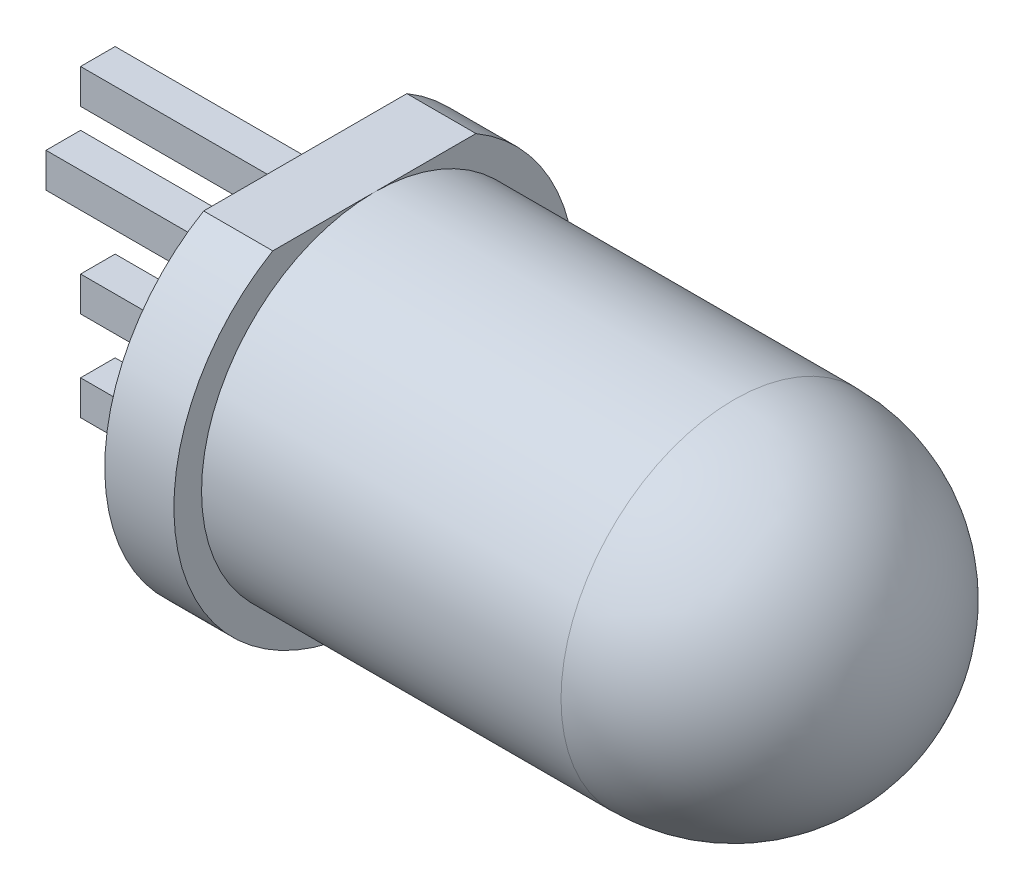
from build123d import *

# Parameters (mm, degrees)
SKETCH_3_W               = 1
SKETCH_3_H               = 2.9
CUT_EXTRUDE_1_DEPTH      = 10
SKETCH_5_W               = 0.5
SKETCH_5_H               = 0.5
EXTRUDE_1_DEPTH          = 3
SKETCH_5_3_W             = 0.5
SKETCH_5_3_H             = 0.5
EXTRUDE_2_DEPTH          = 3.5
CUT_EXTRUDE_2_DEPTH      = 5
CUT_EXTRUDE_2_DEPTH_BACK = 1
SKETCH_7_R               = 2
EXTRUDE_3_DEPTH          = 0.25
EXTRUDE_3_DEPTH_BACK     = 0.25


with BuildPart() as part:
    # 草图1 → 旋转1 (revolve)
    with BuildSketch(Plane.XY):
        with BuildLine():
            Line((0, 0), (8.7, 0))
            ThreePointArc((8.7, 0), (7.967766953, 1.767766953), (6.2, 2.5))
            Line((6.2, 2.5), (0, 2.5))
            Line((0, 2.5), (0, 0))
        make_face()
    revolve(axis=Axis((0, 0, 0), (1, 0, 0)))

    # 草图3 → 旋转2 (revolve)
    with BuildSketch(Plane.XY, mode=Mode.PRIVATE) as revolve_2_sk:
        with Locations((0.5, 1.45)):
            Rectangle(SKETCH_3_W, SKETCH_3_H)
    revolve(revolve_2_sk.sketch.rotate(Axis((0, 0, 0), (1, 0, 0)), 90), axis=Axis((0, 0, 0), (1, 0, 0)))

    # 草图4 → 切除-拉伸1 (cut)
    with BuildSketch(Plane.ZY):
        with BuildLine():
            Line((-1.469693846, 2.5), (1.469693846, 2.5))
            ThreePointArc((1.469693846, 2.5), (0, 2.9), (-1.469693846, 2.5))
        make_face()
    extrude(amount=-CUT_EXTRUDE_1_DEPTH, mode=Mode.SUBTRACT)

    # 草图5 → 凸台-拉伸1 (add)
    with BuildSketch(Plane.ZY):
        with Locations((0, 1.95)):
            Rectangle(SKETCH_5_W, SKETCH_5_H)
        with Locations((0, -0.65)):
            Rectangle(SKETCH_5_W, SKETCH_5_H)
        with Locations((0, -1.95)):
            Rectangle(SKETCH_5_W, SKETCH_5_H)
    extrude(amount=EXTRUDE_1_DEPTH)

    # 草图5<3> → 凸台-拉伸2 (add)
    with BuildSketch(Plane.ZY):
        with Locations((0, 0.65)):
            Rectangle(SKETCH_5_3_W, SKETCH_5_3_H)
    extrude(amount=EXTRUDE_2_DEPTH)

    # 草图7 → 切除-拉伸2 (cut, two sides: drawn at the far end of the back side and taken through both)
    with BuildSketch(Plane(origin=(1, 0, 0), x_dir=(0, 0, -1), z_dir=(1, 0, 0)).offset(-CUT_EXTRUDE_2_DEPTH_BACK)):
        Circle(SKETCH_7_R)
    extrude(amount=CUT_EXTRUDE_2_DEPTH + CUT_EXTRUDE_2_DEPTH_BACK, mode=Mode.SUBTRACT)


with BuildPart() as cut_extrude_2_piece_1:
    # of the separate pieces the step leaves, piece 1, a body of its own (cut_extrude_2_pieces)
    add(part.part.solids().sort_by_distance((8.7, 0, 0))[0])

    # 草图6 → 凸台-拉伸3 (add, two sides: drawn at the far end of the back side and taken through both)
    with BuildSketch(Plane.XY.offset(-EXTRUDE_3_DEPTH_BACK)):
        Polygon((1, 2.2), (3.977000914, 2.2), (4.190377097, 2.408020966), (4.455092421, 1.929825542), (4.318465157, 1.69072783), (3.874426549, 1.8), (1, 1.8), (0, 1.7), (0, 2.2), align=None)
        Polygon((1, 1.02893952), (3.874426549, 1.02893952), (4.96616378, 1.69072783), (5.47723514, -0.12385302), (4.455092421, -0.477376065), (3.874426549, 0.229670026), (1, 0.229670026), (0, 0.4), (0, 0.9), align=None)
        Polygon((1, -0.477376065), (4.042648868, -0.477376065), (4.455092421, -0.76429332), (5.374764692, -0.76429332), (5.374764692, -1.051210574), (4.455092421, -1.051210574), (3.874426549, -0.825775589), (1, -0.825775589), (0, -0.9), (0, -0.4), align=None)
        Polygon((1, -1.831047036), (5.374764692, -1.831047036), (5.374764692, -2.075012613), (1, -2.075012613), (0, -2.2), (0, -1.7), align=None)
    extrude(amount=EXTRUDE_3_DEPTH + EXTRUDE_3_DEPTH_BACK)


with BuildPart() as cut_extrude_2_piece_2:
    # of the separate pieces the step leaves, piece 2, a body of its own (cut_extrude_2_pieces)
    add(part.part.solids().sort_by_distance((0, 0.9, -0.25))[0])


with BuildPart() as cut_extrude_2_piece_3:
    # of the separate pieces the step leaves, piece 3, a body of its own (cut_extrude_2_pieces)
    add(part.part.solids().sort_by_distance((0, -0.4, -0.25))[0])


with BuildPart() as extrude_3_piece_1:
    # of the separate pieces the step leaves, piece 1, a body of its own (extrude_3_pieces)
    add(cut_extrude_2_piece_1.part.solids().sort_by_distance((8.7, 0, 0))[0])


with BuildPart() as extrude_3_piece_2:
    # of the separate pieces the step leaves, piece 2, a body of its own (extrude_3_pieces)
    add(cut_extrude_2_piece_1.part.solids().sort_by_distance((1, 1.02893952, 0.25))[0])


with BuildPart() as extrude_3_piece_3:
    # of the separate pieces the step leaves, piece 3, a body of its own (extrude_3_pieces)
    add(cut_extrude_2_piece_1.part.solids().sort_by_distance((1, -0.477376065, 0.25))[0])


solid = Compound([cut_extrude_2_piece_2.part, cut_extrude_2_piece_3.part, extrude_3_piece_1.part, extrude_3_piece_2.part, extrude_3_piece_3.part])
